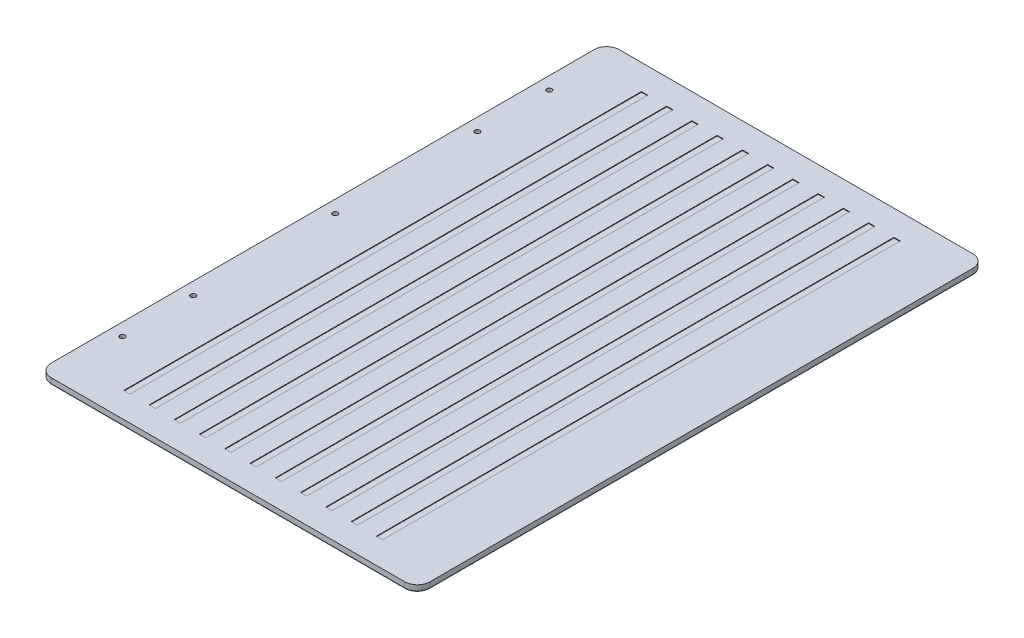
from build123d import *

# Parameters (mm, degrees)
SKETCH1_W           = 300
SKETCH1_H           = 450
BOSS_EXTRUDE1_DEPTH = 5
SKETCH2_R           = 2
CUT_EXTRUDE1_DEPTH  = 271.462566726
FILLET2_R           = 10
FILLET1_R           = 1
SKETCH3_W           = 5
SKETCH3_H           = 410
CUT_EXTRUDE2_DEPTH  = 0.5


with BuildPart() as part:
    # Sketch1 → Boss-Extrude1 (new body)
    with BuildSketch(Plane(origin=(0, 0, 0), x_dir=(1, 0, 0), z_dir=(0, 1, 0))):
        Rectangle(SKETCH1_W, SKETCH1_H)
    extrude(amount=BOSS_EXTRUDE1_DEPTH)

    # Sketch2 → Cut-Extrude1 (cut, through all)
    with BuildSketch(Plane(origin=(0, 5, 0), x_dir=(1, 0, 0), z_dir=(0, 1, 0))):
        with Locations(Location((-140, 0, 0), (0, 0, 270))):
            Circle(SKETCH2_R)
        with Locations(Location((-140, 112.5, 0), (0, 0, 270))):
            Circle(SKETCH2_R)
        with Locations(Location((-140, -112.5, 0), (0, 0, 270))):
            Circle(SKETCH2_R)
        with Locations(Location((-140, 169.5, 0), (0, 0, 270))):
            Circle(SKETCH2_R)
        with Locations(Location((-140, -168.5, 0), (0, 0, 270))):
            Circle(SKETCH2_R)
    extrude(amount=-CUT_EXTRUDE1_DEPTH, mode=Mode.SUBTRACT)

    # Fillet2
    fillet2_edges = [part.edges().sort_by_distance(p)[0] for p in [
        (150, 2.5, 225),
        (-150, 2.5, 225),
        (-150, 2.5, -225),
        (150, 2.5, -225),
    ]]
    fillet(fillet2_edges, radius=FILLET2_R)

    # Fillet1
    fillet1_edges = [part.edges().sort_by_distance(p)[0] for p in [
        (-150, 0, 0),
        (150, 0, 0),
        (0, 0, 225),
        (0, 0, -225),
        (-147.071067812, 0, 222.071067812),
        (147.071067812, 0, 222.071067812),
        (147.071067812, 0, -222.071067812),
        (-147.071067812, 0, -222.071067812),
    ]]
    fillet(fillet1_edges, radius=FILLET1_R)

    # Sketch3 → Cut-Extrude2 (cut)
    with BuildSketch(Plane(origin=(0, 5, 0), x_dir=(1, 0, 0), z_dir=(0, 1, 0))):
        with Locations((20, 0)):
            Rectangle(SKETCH3_W, SKETCH3_H)
        Rectangle(SKETCH3_W, SKETCH3_H)
        with Locations((40, 0)):
            Rectangle(SKETCH3_W, SKETCH3_H)
        with Locations((60, 0)):
            Rectangle(SKETCH3_W, SKETCH3_H)
        with Locations((80, 0)):
            Rectangle(SKETCH3_W, SKETCH3_H)
        with Locations((100, 0)):
            Rectangle(SKETCH3_W, SKETCH3_H)
        with Locations((-20, 0)):
            Rectangle(SKETCH3_W, SKETCH3_H)
        with Locations((-40, 0)):
            Rectangle(SKETCH3_W, SKETCH3_H)
        with Locations((-60, 0)):
            Rectangle(SKETCH3_W, SKETCH3_H)
        with Locations((-80, 0)):
            Rectangle(SKETCH3_W, SKETCH3_H)
        with Locations((-100, 0)):
            Rectangle(SKETCH3_W, SKETCH3_H)
    extrude(amount=-CUT_EXTRUDE2_DEPTH, mode=Mode.SUBTRACT)


solid = part.part
